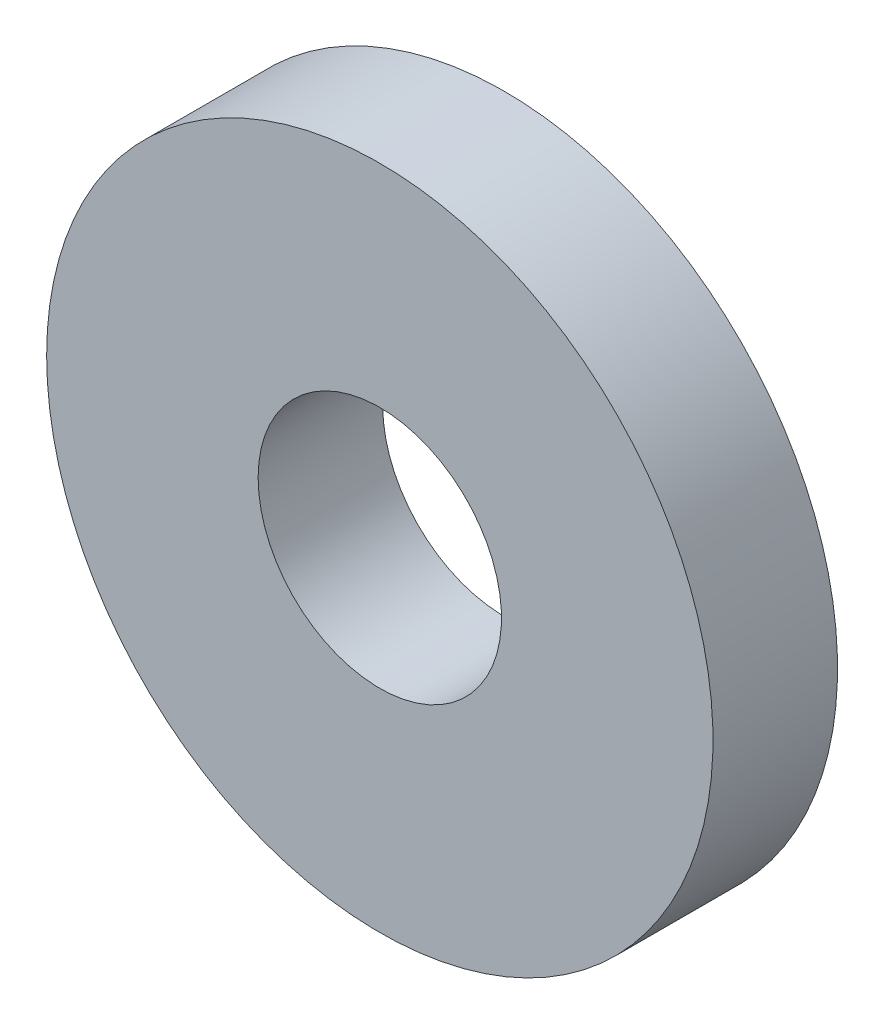
from build123d import *

# Parameters (mm, degrees)
SKETCH1_R           = 11.5
SKETCH1_R_2         = 4.2
BOSS_EXTRUDE1_DEPTH = 4.3


with BuildPart() as part:
    # Sketch1 → Boss-Extrude1 (new body)
    with BuildSketch(Plane.XY):
        Circle(SKETCH1_R)
        Circle(SKETCH1_R_2, mode=Mode.SUBTRACT)
    extrude(amount=BOSS_EXTRUDE1_DEPTH)


solid = part.part
